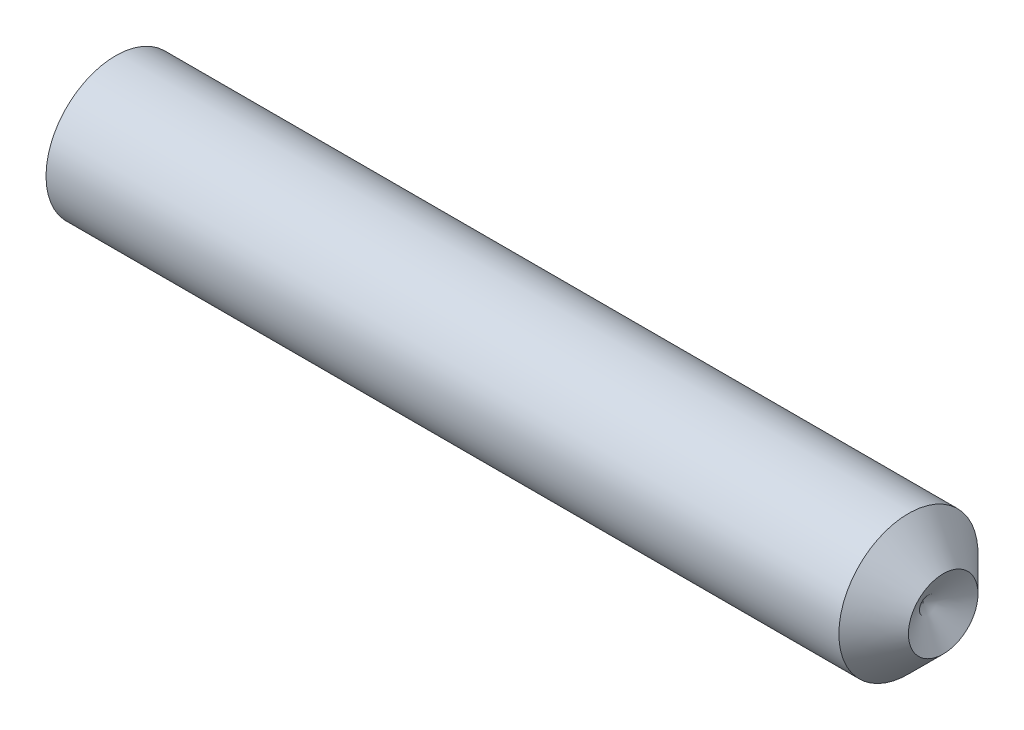
from build123d import *

# Parameters (mm, degrees)
HEX_2_DEPTH = 2


with BuildPart() as part:
    # BodySke → BaseBody (revolve)
    with BuildSketch(Plane.XY, mode=Mode.PRIVATE) as basebody_sk:
        Polygon((0, 0), (0, 2.055), (0.25692087, 2.5), (28.75, 2.5), (30, 1.25), (29.278312164, 0), align=None)
    revolve(basebody_sk.sketch.rotate(Axis((-12.7, 0, 0), (1, 0, 0)), 90), axis=Axis((-12.7, 0, 0), (1, 0, 0)))

    # Sketch2 → Hex 2 (cut)
    with BuildSketch(Plane.ZY):
        Polygon((0.721687836, 1.25), (-0.721687836, 1.25), (-1.443375673, 0), (-0.721687836, -1.25), (0.721687836, -1.25), (1.443375673, 0), align=None)
    extrude(amount=-HEX_2_DEPTH, mode=Mode.SUBTRACT)


solid = part.part
